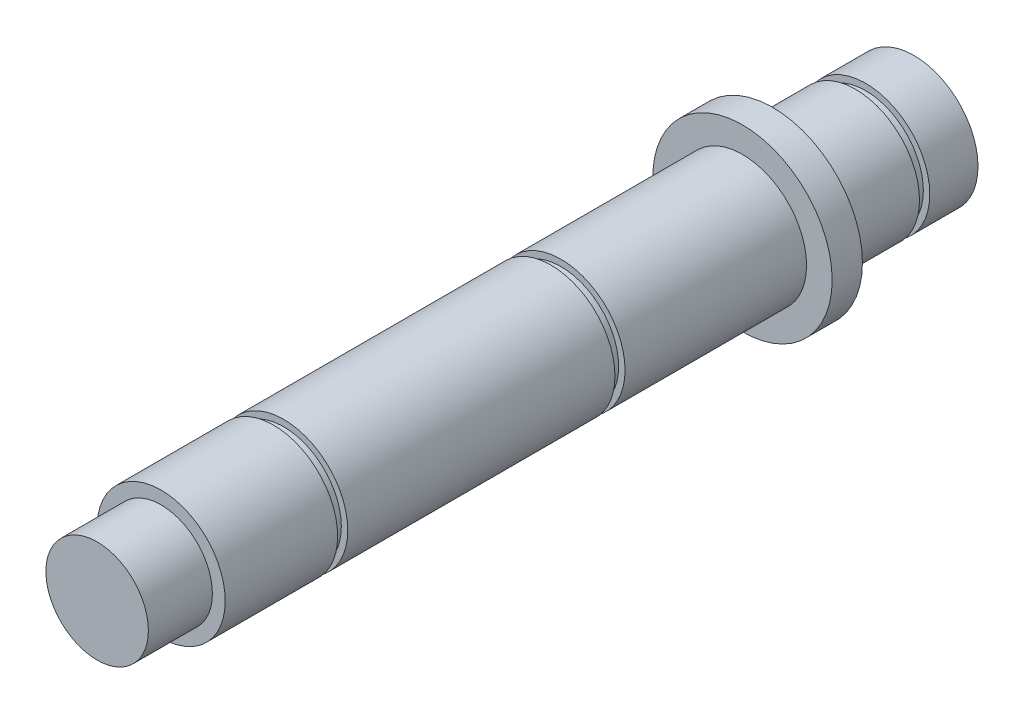
from build123d import *

# Parameters (mm, degrees)
SKETCH1_R           = 6.35
BOSS_EXTRUDE1_DEPTH = 81
CUT_EXTRUDE1_START  = -75.2
SKETCH2_R           = 12.7
SKETCH2_R_2         = 5.715
CUT_EXTRUDE1_DEPTH  = 1.016
BOSS_EXTRUDE2_START = -67
SKETCH3_R           = 8.89
BOSS_EXTRUDE2_DEPTH = 3
SKETCH4_R           = 7.62
SKETCH4_R_2         = 5.08
CUT_EXTRUDE2_DEPTH  = 6.35
CUT_EXTRUDE4_START  = -17.5
SKETCH5_R           = 12.7
SKETCH5_R_2         = 5.715
CUT_EXTRUDE4_DEPTH  = 1
CUT_EXTRUDE5_START  = -45
SKETCH6_R           = 12.7
SKETCH6_R_2         = 5.715
CUT_EXTRUDE5_DEPTH  = 1


with BuildPart() as part:
    # Sketch1 → Boss-Extrude1 (new body)
    with BuildSketch(Plane.XY):
        Circle(SKETCH1_R)
    extrude(amount=-BOSS_EXTRUDE1_DEPTH)

    # Sketch2 → Cut-Extrude1 (cut)
    with BuildSketch(Plane.XY.offset(CUT_EXTRUDE1_START)):
        with Locations((0.049037486, 0)):
            Circle(SKETCH2_R)
        Circle(SKETCH2_R_2, mode=Mode.SUBTRACT)
    extrude(amount=-CUT_EXTRUDE1_DEPTH, mode=Mode.SUBTRACT)

    # Sketch3 → Boss-Extrude2 (add)
    with BuildSketch(Plane.XY.offset(BOSS_EXTRUDE2_START)):
        Circle(SKETCH3_R)
    extrude(amount=BOSS_EXTRUDE2_DEPTH)

    # Sketch4 → Cut-Extrude2 (cut)
    with BuildSketch(Plane.XY):
        Circle(SKETCH4_R)
        Circle(SKETCH4_R_2, mode=Mode.SUBTRACT)
    extrude(amount=-CUT_EXTRUDE2_DEPTH, mode=Mode.SUBTRACT)

    # Sketch5 → Cut-Extrude4 (cut)
    with BuildSketch(Plane.XY.offset(CUT_EXTRUDE4_START)):
        Circle(SKETCH5_R)
        Circle(SKETCH5_R_2, mode=Mode.SUBTRACT)
    extrude(amount=-CUT_EXTRUDE4_DEPTH, mode=Mode.SUBTRACT)

    # Sketch6 → Cut-Extrude5 (cut)
    with BuildSketch(Plane.XY.offset(CUT_EXTRUDE5_START)):
        Circle(SKETCH6_R)
        Circle(SKETCH6_R_2, mode=Mode.SUBTRACT)
    extrude(amount=-CUT_EXTRUDE5_DEPTH, mode=Mode.SUBTRACT)


solid = part.part
